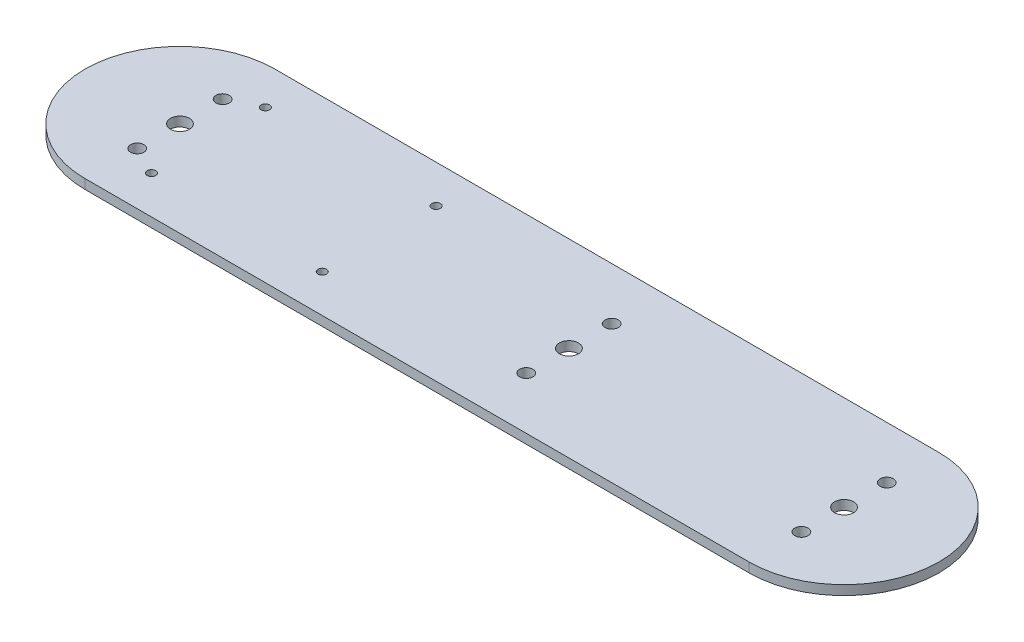
from build123d import *

# Parameters (mm, degrees)
SKETCH1_R           = 5
SKETCH1_R_2         = 3.5
BOSS_EXTRUDE1_DEPTH = 5
SKETCH2_R           = 3.5
SKETCH2_R_2         = 2.25
SKETCH2_R_3         = 5
CUT_EXTRUDE1_DEPTH  = 5


with BuildPart() as part:
    # Sketch1 → Boss-Extrude1 (new body)
    with BuildSketch(Plane(origin=(0, 0, 0), x_dir=(1, 0, 0), z_dir=(0, 1, 0))):
        with BuildLine():
            Line((0, 50), (350, 50))
            ThreePointArc((350, 50), (400, 0), (350, -50))
            Line((350, -50), (0, -50))
            ThreePointArc((0, -50), (-50, 0), (0, 50))
        make_face()
        with Locations(Location((0, 0, 0), (0, 0, 270))):
            Circle(SKETCH1_R, mode=Mode.SUBTRACT)
        with Locations(Location((350, 0, 0), (0, 0, 270))):
            Circle(SKETCH1_R, mode=Mode.SUBTRACT)
        with Locations(Location((0, 22.5, 0), (0, 0, 270))):
            Circle(SKETCH1_R_2, mode=Mode.SUBTRACT)
        with Locations(Location((350, 22.5, 0), (0, 0, 270))):
            Circle(SKETCH1_R_2, mode=Mode.SUBTRACT)
        with Locations(Location((350, -22.5, 0), (0, 0, 90))):
            Circle(SKETCH1_R_2, mode=Mode.SUBTRACT)
        with Locations(Location((0, -22.5, 0), (0, 0, 90))):
            Circle(SKETCH1_R_2, mode=Mode.SUBTRACT)
    extrude(amount=BOSS_EXTRUDE1_DEPTH)

    # Sketch2 → Cut-Extrude1 (cut)
    with BuildSketch(Plane(origin=(0, 5, 0), x_dir=(1, 0, 0), z_dir=(0, 1, 0))):
        with Locations(Location((205, 22.5, 0), (0, 0, 270))):
            Circle(SKETCH2_R)
        with Locations(Location((15, -30, 0), (0, 0, 270))):
            Circle(SKETCH2_R_2)
        with Locations(Location((105, -30, 0), (0, 0, 270))):
            Circle(SKETCH2_R_2)
        with Locations(Location((105, 30, 0), (0, 0, 270))):
            Circle(SKETCH2_R_2)
        with Locations(Location((15, 30, 0), (0, 0, 270))):
            Circle(SKETCH2_R_2)
        with Locations(Location((205, 0, 0), (0, 0, 270))):
            Circle(SKETCH2_R_3)
        with Locations(Location((205, -22.5, 0), (0, 0, 270))):
            Circle(SKETCH2_R)
    extrude(amount=-CUT_EXTRUDE1_DEPTH, mode=Mode.SUBTRACT)


solid = part.part
